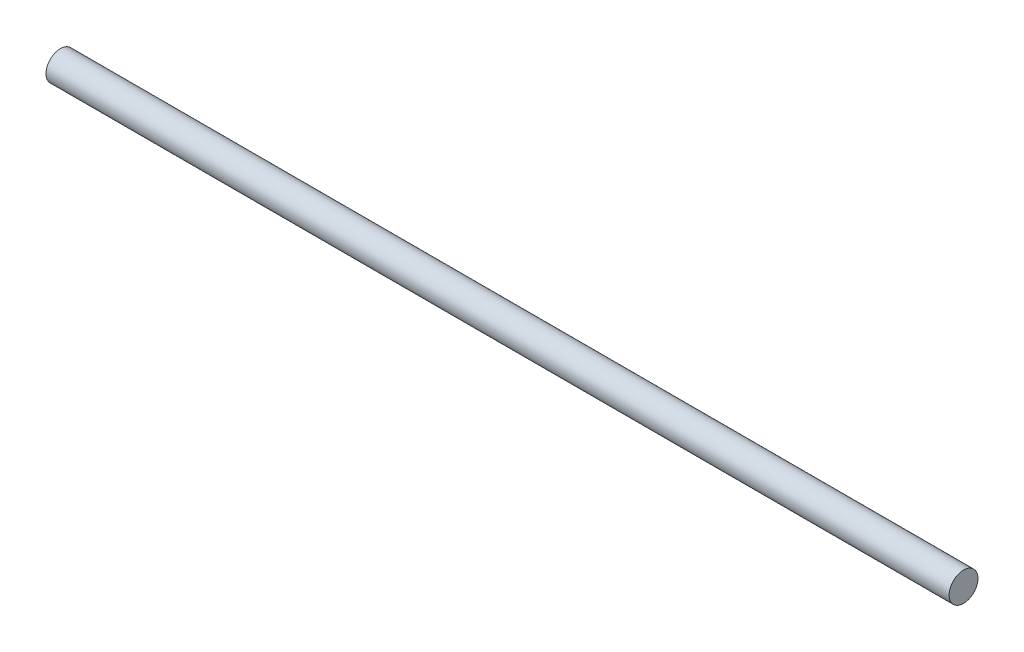
from build123d import *

# Parameters (mm, degrees)
SKETCH_1_R      = 4
EXTRUDE_1_DEPTH = 250


with BuildPart() as part:
    # 草图1 → 凸台-拉伸1 (new body)
    with BuildSketch(Plane(origin=(0, 0, 0), x_dir=(0, 0, -1), z_dir=(1, 0, 0))):
        Circle(SKETCH_1_R)
    extrude(amount=EXTRUDE_1_DEPTH)


solid = part.part
